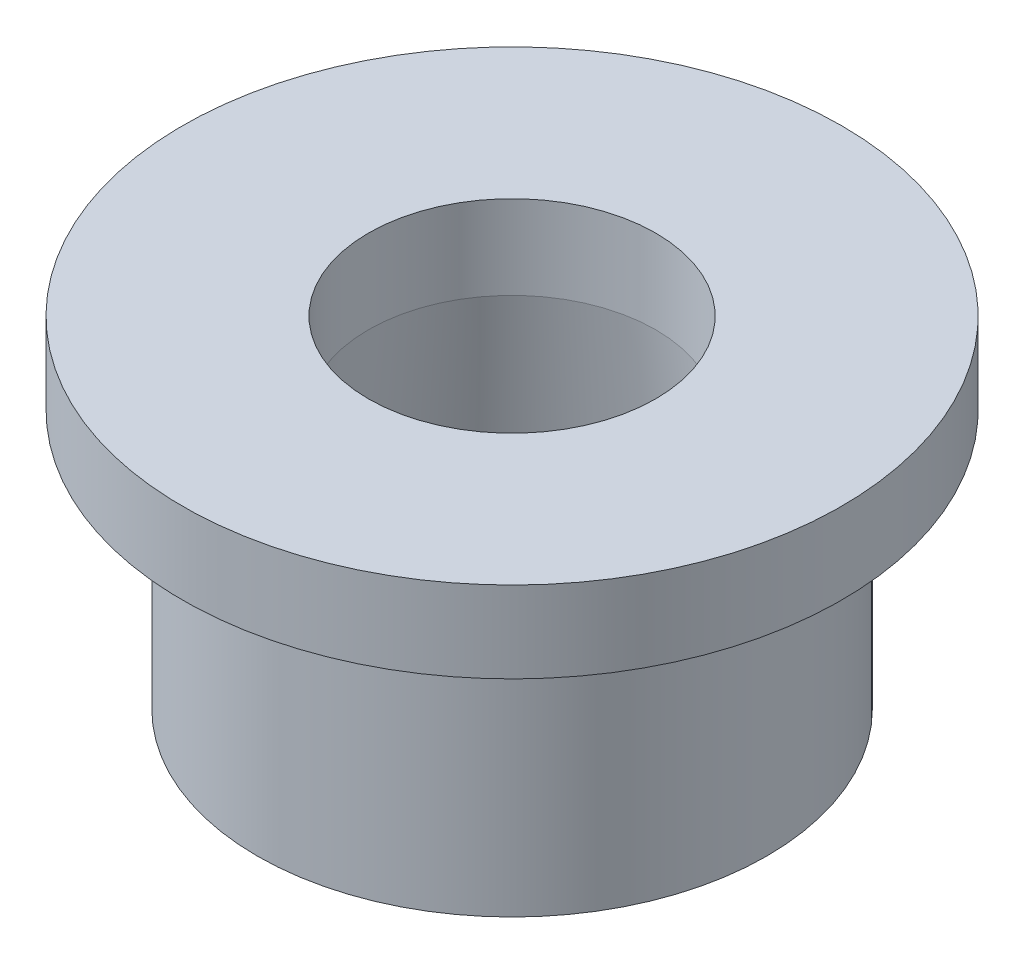
from build123d import *


with BuildPart() as part:
    # Sketch1 → Revolve1 (revolve)
    with BuildSketch(Plane.XY, mode=Mode.PRIVATE) as revolve1_sk:
        Polygon((3.3655, 7.9756), (3.3655, 6.013808148), (4.064, 0), (5.969, 0), (5.969, 4.9784), (7.7216, 6.0706), (7.7216, 7.9756), align=None)
    revolve(revolve1_sk.sketch.rotate(Axis((0, 0, 0), (0, 1, 0)), 90), axis=Axis((0, 0, 0), (0, 1, 0)))


solid = part.part
